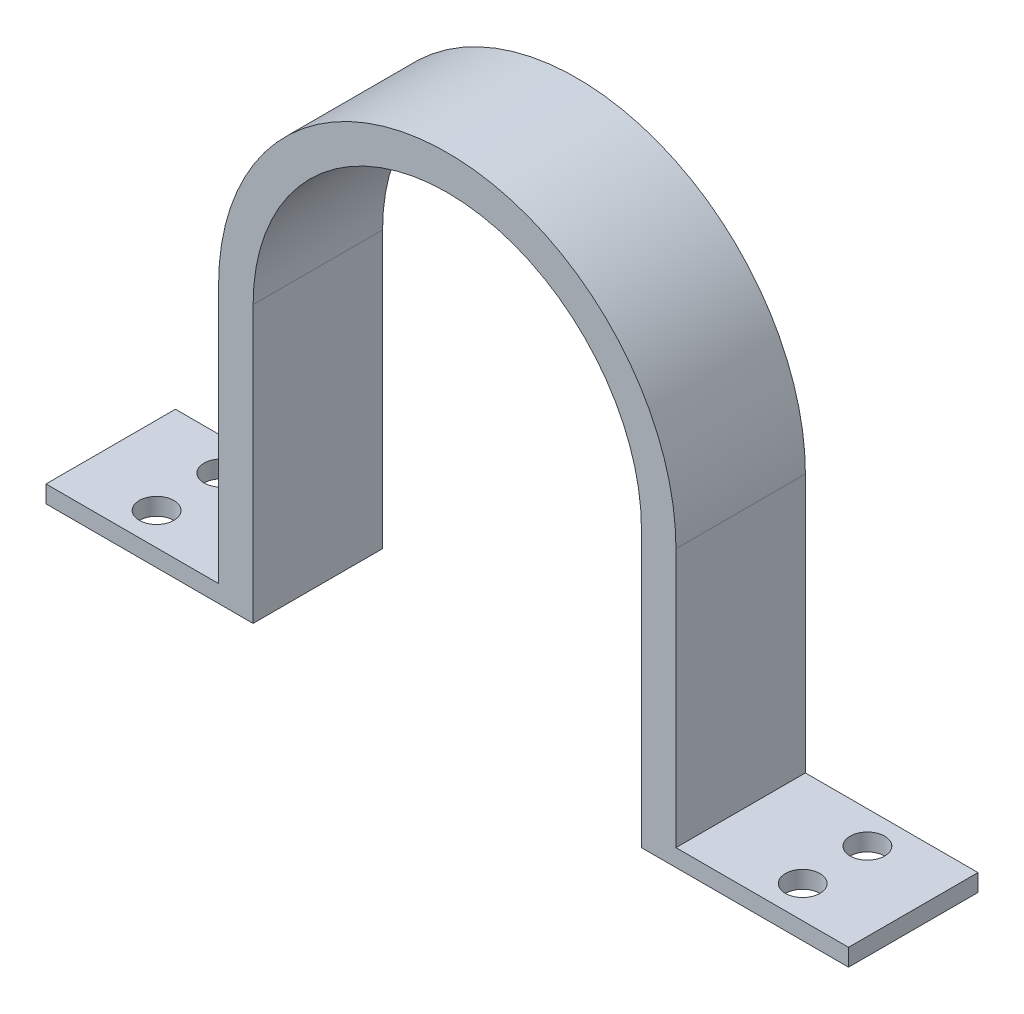
from build123d import *

# Parameters (mm, degrees)
BOSS_EXTRUDE1_DEPTH = 15
SKETCH2_R           = 2
CUT_EXTRUDE1_DEPTH  = 75.696050766


with BuildPart() as part:
    # Sketch1 → Boss-Extrude1 (new body)
    with BuildSketch(Plane.XY):
        with BuildLine():
            Line((-22.5, 30), (-22.5, 0))
            Line((-22.5, 0), (-22.5, -2))
            Line((-22.5, -2), (-46.5, -2))
            Line((-46.5, -2), (-46.5, 0))
            Line((-46.5, 0), (-26.5, 0))
            Line((-26.5, 0), (-26.5, 30))
            ThreePointArc((-26.5, 30), (0, 56.5), (26.5, 30))
            Line((26.5, 30), (26.5, 0))
            Line((26.5, 0), (46.5, 0))
            Line((46.5, 0), (46.5, -2))
            Line((46.5, -2), (22.5, -2))
            Line((22.5, -2), (22.5, 0))
            Line((22.5, 0), (22.5, 30))
            ThreePointArc((22.5, 30), (0, 52.5), (-22.5, 30))
        make_face()
    extrude(amount=BOSS_EXTRUDE1_DEPTH)

    # Sketch2 → Cut-Extrude1 (cut, through all)
    with BuildSketch(Plane(origin=(0, 0, 0), x_dir=(1, 0, 0), z_dir=(0, 1, 0))):
        with Locations(Location((-37.435032434, -3.75, 0), (0, 0, 180))):
            Circle(SKETCH2_R)
        with Locations(Location((-37.435032434, -11.25, 0), (0, 0, 180))):
            Circle(SKETCH2_R)
        with Locations((37.435032434, -11.25)):
            Circle(SKETCH2_R)
        with Locations((37.435032434, -3.75)):
            Circle(SKETCH2_R)
    extrude(amount=-CUT_EXTRUDE1_DEPTH, mode=Mode.SUBTRACT)


solid = part.part
